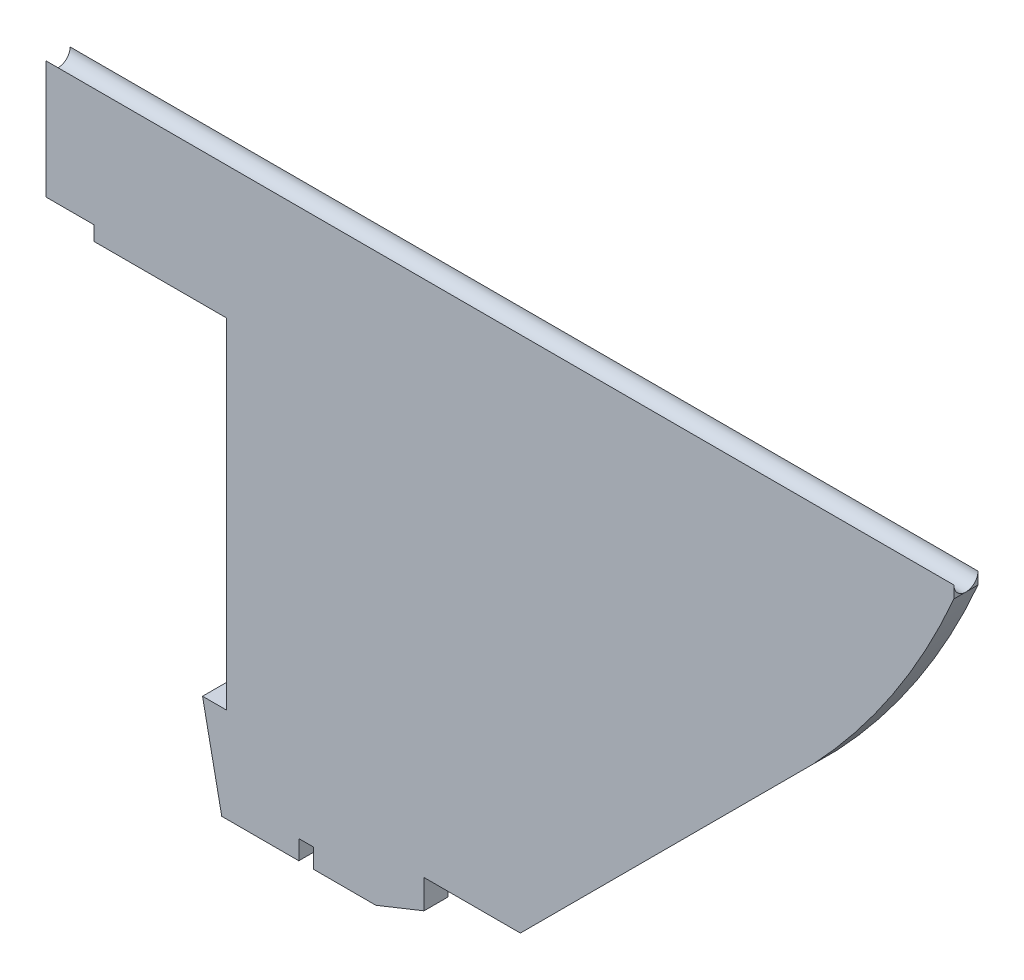
from build123d import *

# Parameters (mm, degrees)
BOSS_EXTRU_1_DEPTH      = 5
ESQUISSE3_W             = 10
ESQUISSE3_H             = 3
ENL_V_MAT_EXTRU_1_DEPTH = 231.967242256
ENL_V_MAT_EXTRU_2_DEPTH = 231.967242256
ENL_V_MAT_EXTRU_3_DEPTH = 231.967242256
BOSS_EXTRU_2_DEPTH      = 188.5
ESQUISSE6_W             = 3
ESQUISSE6_H             = 4
ENL_V_MAT_EXTRU_4_DEPTH = 221.918340892


with BuildPart() as part:
    # Esquisse1 → Boss.-Extru.1 (new body)
    with BuildSketch(Plane.XY):
        with BuildLine():
            Line((0, 0), (0, -25))
            Line((0, -25), (37.5, -25))
            Line((37.5, -25), (37.5, -95.5))
            Line((37.5, -95.5), (32.5, -95.5))
            Line((32.5, -95.5), (36.487358688, -115.098494092))
            Line((36.487358688, -115.098494092), (88.487358688, -115.098494092))
            Line((88.487358688, -115.098494092), (159.198036807, -44.387815974))
            ThreePointArc((159.198036807, -44.387815974), (187.146342861, -3.044299659), (200.182925478, 45.126663235))
            Line((200.182925478, 45.126663235), (43.682925478, 43.998857528))
            ThreePointArc((43.682925478, 43.998857528), (12.775400091, 31.000392909), (0, 0))
        make_face()
    extrude(amount=BOSS_EXTRU_1_DEPTH)

    # Esquisse3 → Enlèv. mat.-Extru.1 (cut, through all)
    with BuildSketch(Plane.XY.offset(5)):
        with Locations((5, -23.5)):
            Rectangle(ESQUISSE3_W, ESQUISSE3_H)
    extrude(amount=-ENL_V_MAT_EXTRU_1_DEPTH, mode=Mode.SUBTRACT)

    # Esquisse4 → Enlèv. mat.-Extru.2 (cut, through all)
    with BuildSketch(Plane.XY.offset(5)):
        Polygon((88.487358688, -105.098494092), (78.487358688, -105.098494092), (78.487358688, -111.098494092), (68.487358688, -115.098494092), (78.487358688, -115.098494092), (88.487358688, -115.098494092), (98.487358688, -105.098494092), align=None)
    extrude(amount=-ENL_V_MAT_EXTRU_2_DEPTH, mode=Mode.SUBTRACT)

    # Esquisse2 → Enlèv. mat.-Extru.3 (cut, through all)
    with BuildSketch(Plane.XY.offset(5)):
        Polygon((0, 0), (188.5, 0), (209.362190725, -2.460738477), (219.452028236, 63.380017622), (19.477580028, 66.088918501), (-15.632624315, 12.443515375), align=None)
    extrude(amount=-ENL_V_MAT_EXTRU_3_DEPTH, mode=Mode.SUBTRACT)

    # Esquisse5 → Boss.-Extru.2 (add)
    with BuildSketch(Plane.ZY):
        with BuildLine():
            Line((2.5, 0), (5, 0))
            Line((5, 0), (5, 2.5))
            ThreePointArc((5, 2.5), (4.267766953, 0.732233047), (2.5, 0))
        make_face()
        with BuildLine():
            Line((0, 0), (2.5, 0))
            ThreePointArc((2.5, 0), (0.732233047, 0.732233047), (0, 2.5))
            Line((0, 2.5), (0, 0))
        make_face()
    extrude(amount=-BOSS_EXTRU_2_DEPTH)

    # Esquisse6 → Enlèv. mat.-Extru.4 (cut, through all)
    with BuildSketch(Plane(origin=(0, 0, 0), x_dir=(-1, 0, 0), z_dir=(0, 0, -1))):
        with Locations((-53.987358688, -113.098494092)):
            Rectangle(ESQUISSE6_W, ESQUISSE6_H)
    extrude(amount=-ENL_V_MAT_EXTRU_4_DEPTH, mode=Mode.SUBTRACT)


solid = part.part
